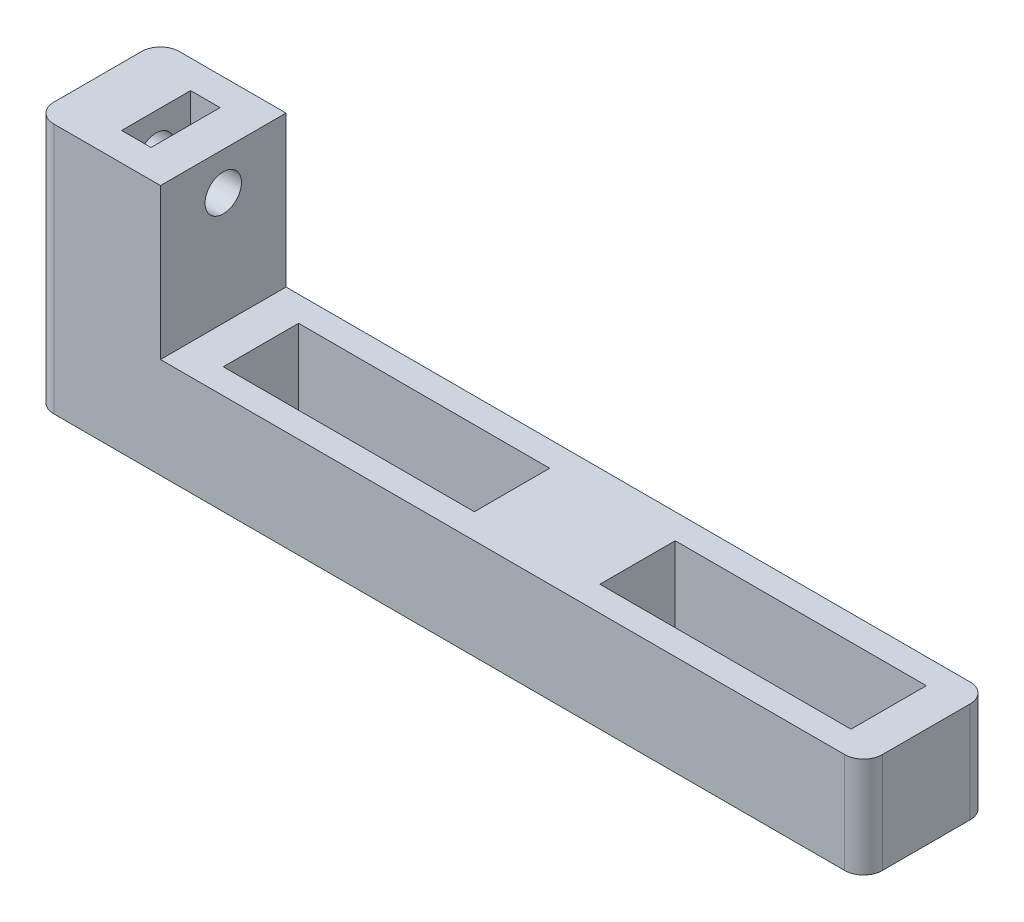
from build123d import *

# Parameters (mm, degrees)
SALIENTE_EXTRUIR1_DEPTH = 10
REDONDEO5_R             = 1.5
CROQUIS3_W              = 20
CROQUIS3_H              = 6
CORTAR_EXTRUIR1_DEPTH   = 6.5
CROQUIS4_W              = 18
CROQUIS4_H              = 2.95
CORTAR_EXTRUIR2_DEPTH   = 1.5
CROQUIS5_R              = 1.45
CORTAR_EXTRUIR3_DEPTH   = 10
CROQUIS6_W              = 2.35
CROQUIS6_H              = 5.5
CORTAR_EXTRUIR4_DEPTH   = 6


with BuildPart() as part:
    # Croquis2 → Saliente-Extruir1 (new body)
    with BuildSketch(Plane.XY):
        Polygon((-160.336548935, 23.55779901), (-160.336548935, 3.55779901), (-94.336548935, 3.55779901), (-94.336548935, 11.55779901), (-150.336548935, 11.55779901), (-150.336548935, 23.55779901), align=None)
    extrude(amount=SALIENTE_EXTRUIR1_DEPTH)

    # Redondeo5
    redondeo5_edges = [part.edges().sort_by_distance(p)[0] for p in [
        (-94.336548935, 7.55779901, 10),
        (-94.336548935, 7.55779901, 0),
        (-160.336548935, 13.55779901, 10),
        (-160.336548935, 13.55779901, 0),
    ]]
    fillet(redondeo5_edges, radius=REDONDEO5_R)

    # Croquis3 → Cortar-Extruir1 (cut)
    with BuildSketch(Plane(origin=(0, 11.55779901, 0), x_dir=(1, 0, 0), z_dir=(0, 1, 0))):
        with Locations((-107.336548935, -5)):
            Rectangle(CROQUIS3_W, CROQUIS3_H)
        with Locations((-137.336548935, -5)):
            Rectangle(CROQUIS3_W, CROQUIS3_H)
    extrude(amount=-CORTAR_EXTRUIR1_DEPTH, mode=Mode.SUBTRACT)

    # Croquis4 → Cortar-Extruir2 (cut)
    with BuildSketch(Plane(origin=(0, 5.05779901, 0), x_dir=(1, 0, 0), z_dir=(0, 1, 0))):
        with Locations((-107.336548935, -4.975)):
            Rectangle(CROQUIS4_W, CROQUIS4_H)
        with Locations((-137.336548935, -4.975)):
            Rectangle(CROQUIS4_W, CROQUIS4_H)
    extrude(amount=-CORTAR_EXTRUIR2_DEPTH, mode=Mode.SUBTRACT)

    # Croquis5 → Cortar-Extruir3 (cut)
    with BuildSketch(Plane(origin=(-150.336548935, 0, 0), x_dir=(0, 0, -1), z_dir=(1, 0, 0))):
        with Locations((-5, 20.55779901)):
            Circle(CROQUIS5_R)
    extrude(amount=-CORTAR_EXTRUIR3_DEPTH, mode=Mode.SUBTRACT)

    # Croquis6 → Cortar-Extruir4 (cut)
    with BuildSketch(Plane(origin=(0, 23.55779901, 0), x_dir=(1, 0, 0), z_dir=(0, 1, 0))):
        with Locations((-154.511548935, -5)):
            Rectangle(CROQUIS6_W, CROQUIS6_H)
    extrude(amount=-CORTAR_EXTRUIR4_DEPTH, mode=Mode.SUBTRACT)


solid = part.part
